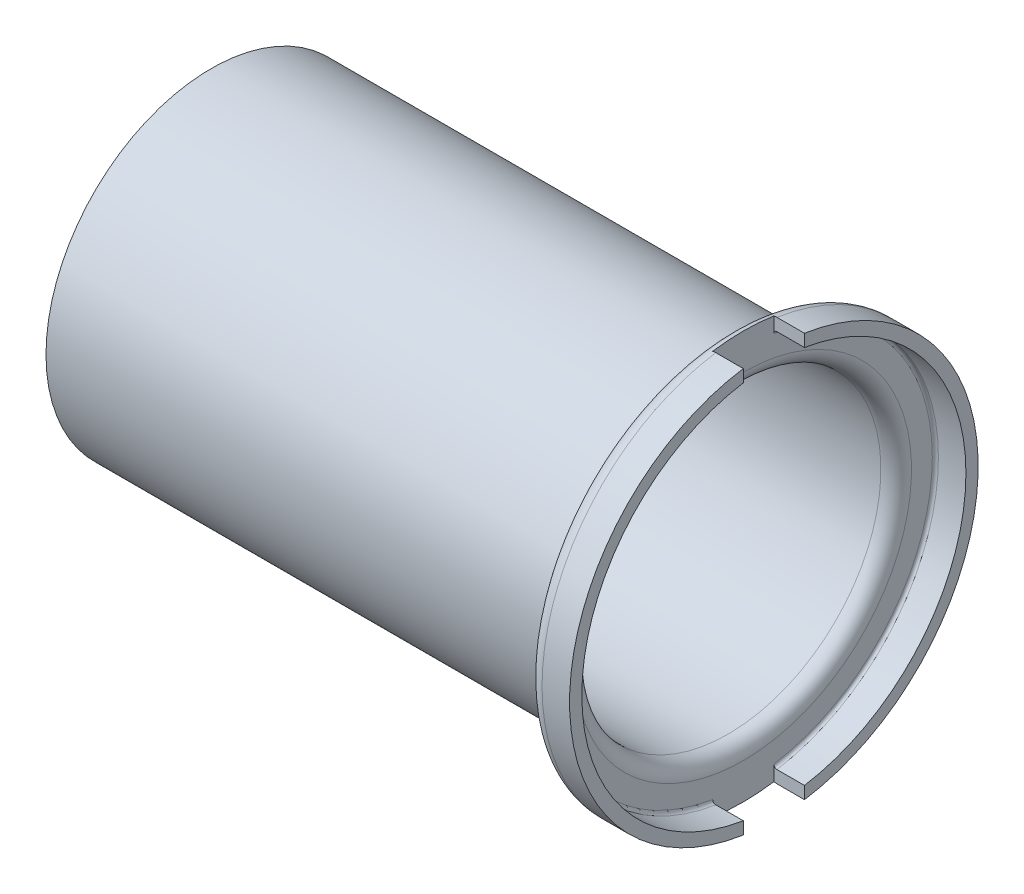
from build123d import *

# Parameters (mm, degrees)
ENL_V_MAT_EXTRU_1_DEPTH      = 104.417213267
ENL_V_MAT_EXTRU_1_DEPTH_BACK = 104.417213267
ESQUISSE2_W                  = 5
ESQUISSE2_H                  = 10


with BuildPart() as part:
    # Esquisse1 → Base-Révol.-Mince (revolve)
    with BuildSketch(Plane.XY, mode=Mode.PRIVATE) as base_r_vol_mince_sk:
        with BuildLine():
            Line((0, 27), (84.5, 27))
            ThreePointArc((84.5, 27), (84.853553391, 27.146446609), (85, 27.5))
            Line((85, 27.5), (85, 30.9))
            ThreePointArc((85, 30.9), (85.732233047, 32.667766953), (87.5, 33.4))
            Line((87.5, 33.4), (92, 33.4))
            Line((92, 33.4), (92, 31.4))
            Line((92, 31.4), (87.5, 31.4))
            ThreePointArc((87.5, 31.4), (87.146446609, 31.253553391), (87, 30.9))
            Line((87, 30.9), (87, 27.5))
            ThreePointArc((87, 27.5), (86.267766953, 25.732233047), (84.5, 25))
            Line((84.5, 25), (0, 25))
            Line((0, 25), (0, 27))
        make_face()
    revolve(base_r_vol_mince_sk.sketch.rotate(Axis((0, 0, 0), (1, 0, 0)), 90), axis=Axis((0, 0, 0), (1, 0, 0)))

    # Esquisse2 → Enlèv. mat.-Extru.1 (cut, two sides: drawn at the far end of the back side and taken through both)
    with BuildSketch(Plane(origin=(0, 0, 0), x_dir=(1, 0, 0), z_dir=(0, 1, 0)).offset(-ENL_V_MAT_EXTRU_1_DEPTH_BACK)):
        with Locations((89.5, 0)):
            Rectangle(ESQUISSE2_W, ESQUISSE2_H)
    extrude(amount=ENL_V_MAT_EXTRU_1_DEPTH + ENL_V_MAT_EXTRU_1_DEPTH_BACK, mode=Mode.SUBTRACT)


solid = part.part
